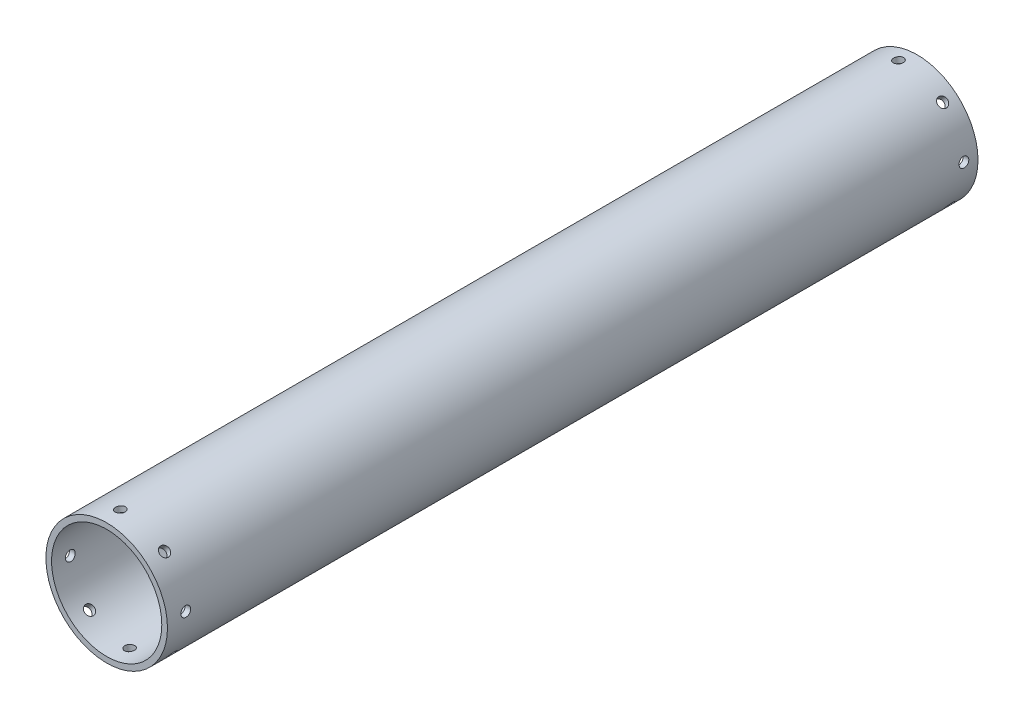
from build123d import *

# Parameters (mm, degrees)
SKETCH1_R           = 37.5
SKETCH1_R_2         = 34
BOSS_EXTRUDE1_DEPTH = 500
CIRPATTERN1_COUNT   = 8
LPATTERN1_COUNT     = 2
LPATTERN1_PITCH     = 480


with BuildPart() as part:
    # Sketch1 → Boss-Extrude1 (new body)
    with BuildSketch(Plane.XY):
        Circle(SKETCH1_R)
        Circle(SKETCH1_R_2, mode=Mode.SUBTRACT)
    extrude(amount=BOSS_EXTRUDE1_DEPTH)

    # Sketch4 → 1/4 (0.236) Diameter Hole1 (revolve, cut)
    with BuildSketch(Plane(origin=(-3.032244698, 37.377205515, 488.562943744), x_dir=(-0.9967254803942281, -0.08085985860051416, 0), z_dir=(0, 0, 1))):
        Polygon((0, 0), (0, 6.1), (2.9972, 4.299100553), (2.9972, 0), align=None)
    f_1_4_0_236_diameter_hole1 = revolve(axis=Axis((-3.5457048, 43.706412315, 488.562943744), (0.08085985860051416, -0.9967254803942281, 0)), mode=Mode.SUBTRACT)

    # CirPattern1: 1/4 (0.236) Diameter Hole1 ×8 about axis
    cirpattern1_axis = Axis((0, 0, 500), (0, 0, -1))
    for i in range(1, CIRPATTERN1_COUNT):
        add(f_1_4_0_236_diameter_hole1.rotate(cirpattern1_axis, i * 360 / CIRPATTERN1_COUNT), mode=Mode.SUBTRACT)

    # LPattern1: 1/4 (0.236) Diameter Hole1 ×2
    with Locations(*[(0, 0, -i * LPATTERN1_PITCH) for i in range(1, LPATTERN1_COUNT)]):
        add(f_1_4_0_236_diameter_hole1, mode=Mode.SUBTRACT)

    # LPattern1 copy 1 sketch → LPattern1 copy 1 (revolve, cut)
    with BuildSketch(Plane(origin=(24.285554693, 28.573796269, 8.562943744), x_dir=(-0.7619679005103869, 0.6476147918259689, 0), z_dir=(0, 0, 1))):
        Polygon((0, 0), (0, 6.1), (2.9972, 4.299100553), (2.9972, 0), align=None)
    revolve(axis=Axis((28.397908622, 33.412292437, 8.562943744), (-0.6476147918259689, -0.7619679005103869, 0)), mode=Mode.SUBTRACT)

    # LPattern1 copy 2 sketch → LPattern1 copy 2 (revolve, cut)
    with BuildSketch(Plane(origin=(37.377205515, 3.032244698, 8.562943744), x_dir=(-0.08085985860051421, 0.9967254803942281, 0), z_dir=(0, 0, 1))):
        Polygon((0, 0), (0, 6.1), (2.9972, 4.299100553), (2.9972, 0), align=None)
    revolve(axis=Axis((43.706412315, 3.5457048, 8.562943744), (-0.9967254803942281, -0.08085985860051421, 0)), mode=Mode.SUBTRACT)

    # LPattern1 copy 3 sketch → LPattern1 copy 3 (revolve, cut)
    with BuildSketch(Plane(origin=(28.573796269, -24.285554693, 8.562943744), x_dir=(0.6476147918259689, 0.7619679005103869, 0), z_dir=(0, 0, 1))):
        Polygon((0, 0), (0, 6.1), (2.9972, 4.299100553), (2.9972, 0), align=None)
    revolve(axis=Axis((33.412292437, -28.397908622, 8.562943744), (-0.7619679005103869, 0.6476147918259689, 0)), mode=Mode.SUBTRACT)

    # LPattern1 copy 4 sketch → LPattern1 copy 4 (revolve, cut)
    with BuildSketch(Plane(origin=(3.032244698, -37.377205515, 8.562943744), x_dir=(0.9967254803942281, 0.08085985860051428, 0), z_dir=(0, 0, 1))):
        Polygon((0, 0), (0, 6.1), (2.9972, 4.299100553), (2.9972, 0), align=None)
    revolve(axis=Axis((3.5457048, -43.706412315, 8.562943744), (-0.08085985860051428, 0.9967254803942281, 0)), mode=Mode.SUBTRACT)

    # LPattern1 copy 5 sketch → LPattern1 copy 5 (revolve, cut)
    with BuildSketch(Plane(origin=(-24.285554693, -28.573796269, 8.562943744), x_dir=(0.761967900510387, -0.6476147918259689, 0), z_dir=(0, 0, 1))):
        Polygon((0, 0), (0, 6.1), (2.9972, 4.299100553), (2.9972, 0), align=None)
    revolve(axis=Axis((-28.397908622, -33.412292437, 8.562943744), (0.6476147918259689, 0.761967900510387, 0)), mode=Mode.SUBTRACT)

    # LPattern1 copy 6 sketch → LPattern1 copy 6 (revolve, cut)
    with BuildSketch(Plane(origin=(-37.377205515, -3.032244698, 8.562943744), x_dir=(0.08085985860051434, -0.9967254803942281, 0), z_dir=(0, 0, 1))):
        Polygon((0, 0), (0, 6.1), (2.9972, 4.299100553), (2.9972, 0), align=None)
    revolve(axis=Axis((-43.706412315, -3.5457048, 8.562943744), (0.9967254803942281, 0.08085985860051434, 0)), mode=Mode.SUBTRACT)

    # LPattern1 copy 7 sketch → LPattern1 copy 7 (revolve, cut)
    with BuildSketch(Plane(origin=(-28.573796269, 24.285554693, 8.562943744), x_dir=(-0.6476147918259688, -0.761967900510387, 0), z_dir=(0, 0, 1))):
        Polygon((0, 0), (0, 6.1), (2.9972, 4.299100553), (2.9972, 0), align=None)
    revolve(axis=Axis((-33.412292437, 28.397908622, 8.562943744), (0.761967900510387, -0.6476147918259688, 0)), mode=Mode.SUBTRACT)


solid = part.part
